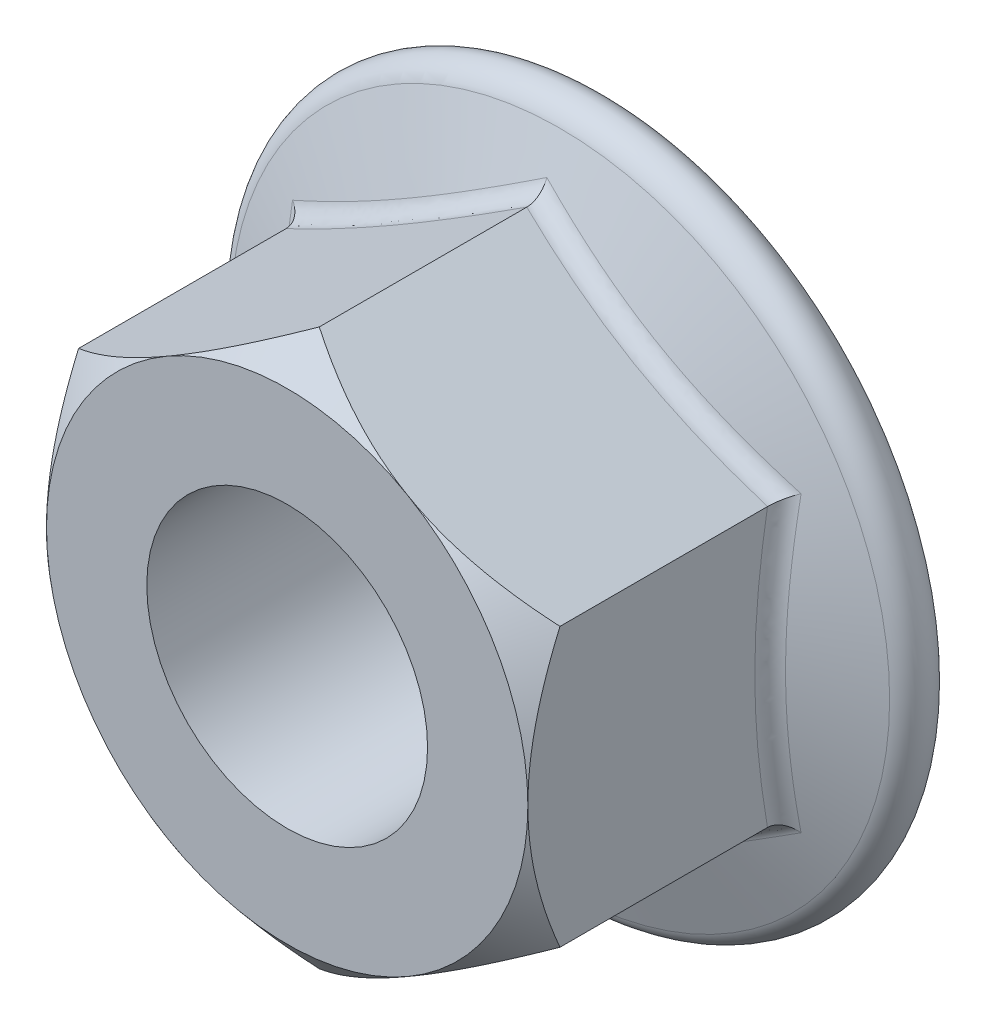
from build123d import *

# Parameters (mm, degrees)
BASENUTSKE_R   = 7
BASENUT_DEPTH  = 16
FLANGEFILLET_R = 0.96


with BuildPart() as part:
    # BaseNutSke → BaseNut (new body)
    with BuildSketch(Plane.XY):
        Polygon((12, 6.92820323), (12, -6.92820323), (0, -13.856406461), (-12, -6.92820323), (-12, 6.92820323), (0, 13.856406461), align=None)
        Circle(BASENUTSKE_R, mode=Mode.SUBTRACT)
    extrude(amount=-BASENUT_DEPTH)

    # Sketch6 → Flange (revolve)
    with BuildSketch(Plane(origin=(0, 0, 0), x_dir=(0, 0, -1), z_dir=(1, 0, 0)), mode=Mode.PRIVATE) as flange_sk:
        with BuildLine():
            Line((10.165622253, 7), (13.6, 16.435875309))
            ThreePointArc((13.6, 16.435875309), (14.977547085, 17.231202489), (16, 16.012690555))
            Line((16, 16.012690555), (16, 7))
            Line((16, 7), (10.165622253, 7))
        make_face()
    revolve(flange_sk.sketch.rotate(Axis((0, 0, 0), (0, 0, -1)), 90), axis=Axis((0, 0, 0), (0, 0, -1)))

    # Sketch3 → Double-Chamfer (revolve, cut)
    with BuildSketch(Plane(origin=(0, 0, 0), x_dir=(0, 0, -1), z_dir=(1, 0, 0)), mode=Mode.PRIVATE) as double_chamfer_sk:
        Polygon((1.6, 26.556406461), (-12.7, 26.556406461), (-12.7, 12), (0, 12), (1.6, 13.856406461), align=None)
    revolve(double_chamfer_sk.sketch.rotate(Axis((0, 0, 0), (0, 0, -1)), 90), axis=Axis((0, 0, 0), (0, 0, -1)), mode=Mode.SUBTRACT)

    # FlangeFillet
    flangefillet_edges = [part.edges().sort_by_distance(p)[0] for p in [
        (12, -3.479213152, -12.16534592),
        (12, 3.479213152, -12.16534592),
        (6, -10.392304845, -11.985473425),
        (6, 10.392304845, -11.985473425),
        (-6, 10.392304845, -11.985473425),
        (-12, 0, -11.985473425),
        (-6, -10.392304845, -11.985473425),
    ]]
    fillet(flangefillet_edges, radius=FLANGEFILLET_R)


solid = part.part
